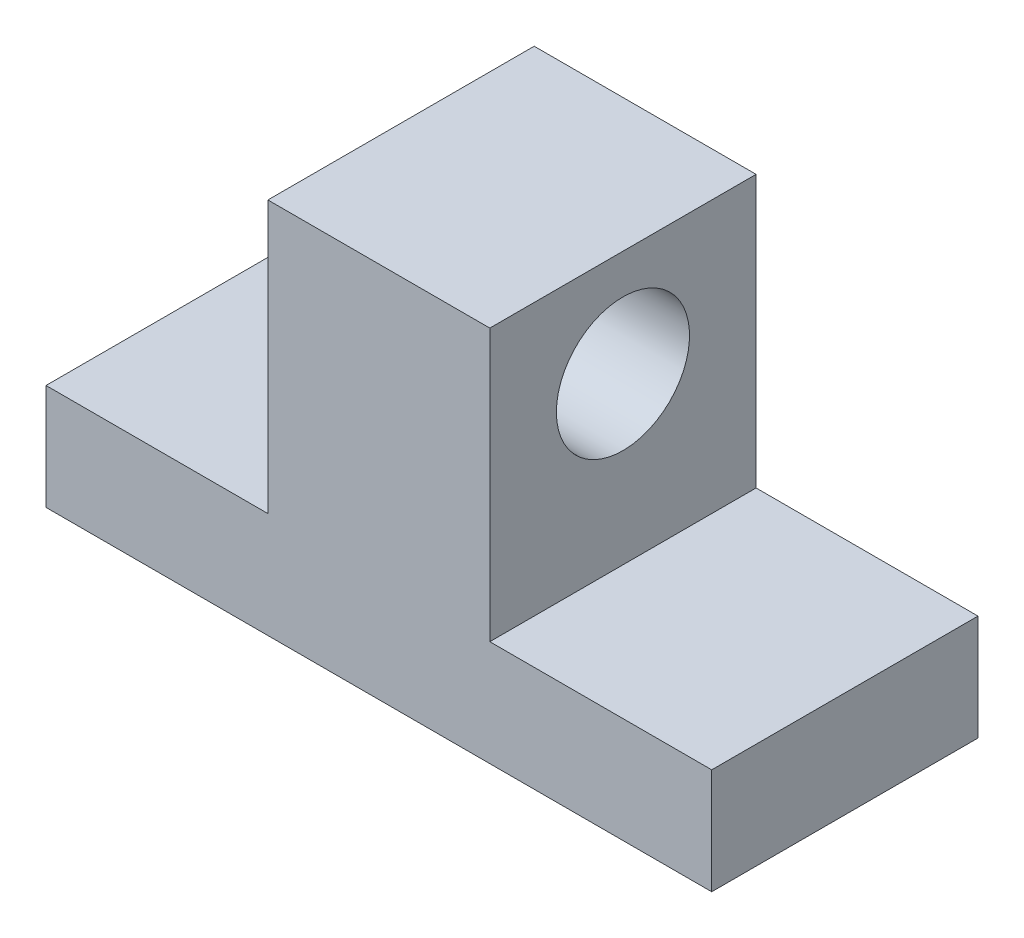
from build123d import *

# Parameters (mm, degrees)
EXTRUDE_2_DEPTH     = 12
SKETCH_4_R          = 3
CUT_EXTRUDE_4_DEPTH = 29.861739379


with BuildPart() as part:
    # Эскиз2 → Вытянуть2 (new body)
    with BuildSketch(Plane.XY):
        Polygon((0.846446281, 0), (-29.153553719, 0), (-29.153553719, 4.760108812), (-19.153553719, 4.760108812), (-19.153553719, 17), (-9.153553719, 17), (-9.153553719, 4.760108812), (0.846446281, 4.760108812), align=None)
    extrude(amount=EXTRUDE_2_DEPTH)

    # Эскиз4 → Вытянуть4 (cut, through all)
    with BuildSketch(Plane.ZY.offset(19.153553719)):
        with Locations((6, 12.217021039)):
            Circle(SKETCH_4_R)
    extrude(amount=-CUT_EXTRUDE_4_DEPTH, mode=Mode.SUBTRACT)


solid = part.part
